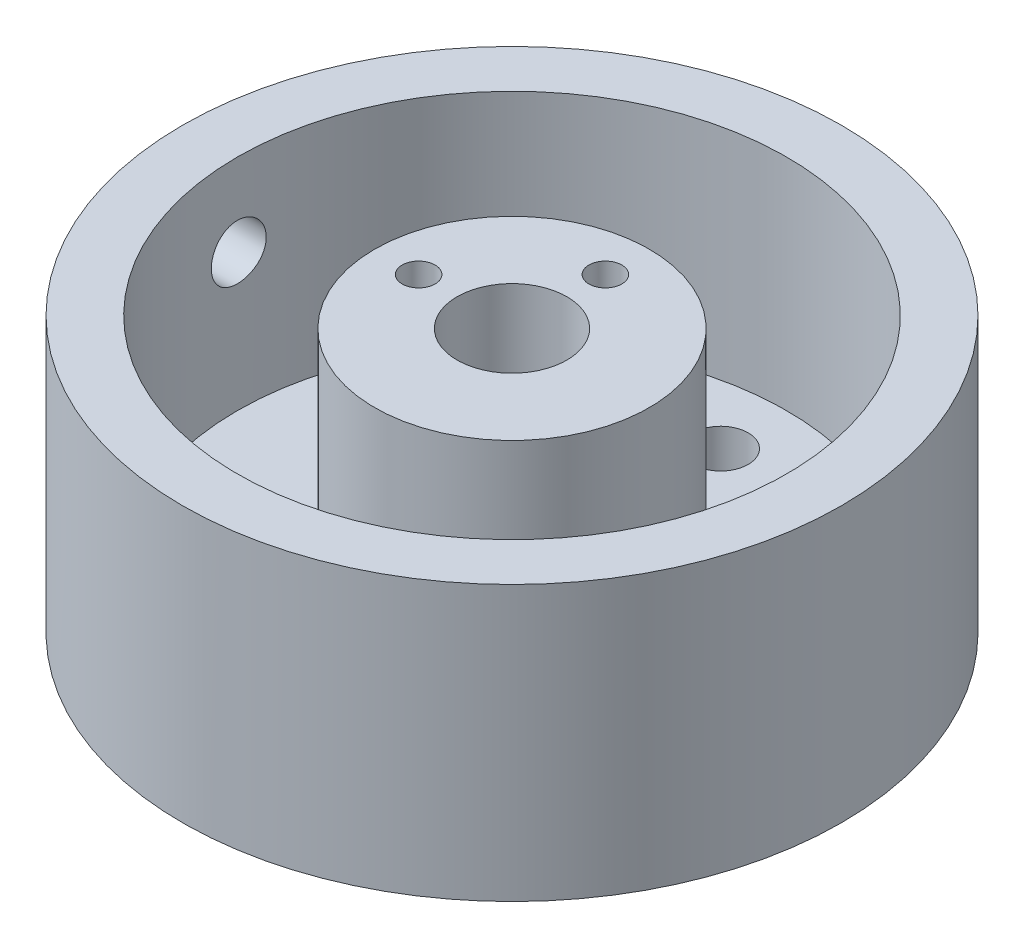
from build123d import *

# Parameters (mm, degrees)
SKETCH2_R                          = 2.5
CUT_EXTRUDE1_DEPTH                 = 10
SKETCH3_R                          = 1.5
CUT_EXTRUDE2_DEPTH                 = 8
SKETCH4_R                          = 1.5
CUT_EXTRUDE3_DEPTH                 = 4
SKETCH5_R                          = 1.5
CUT_EXTRUDE4_DEPTH                 = 4
CUT_EXTRUDE7_DEPTH                 = 10
CUT_EXTRUDE7_DEPTH_BACK            = 10
SKETCH6_R                          = 2.5
BOSS_EXTRUDE5_DEPTH                = 5
BOSS_EXTRUDE5_DEPTH_BACK           = 5
F_5_0_5_DIAMETER_HOLE1_D           = 5
F_5_0_5_DIAMETER_HOLE1_ON_FACE_2_D = 5


with BuildPart() as part:
    # Sketch1 → Revolve2 (revolve)
    with BuildSketch(Plane.XY):
        Polygon((5, 7.28), (5, 0), (30, 0), (30, 25), (25, 25), (25, 5), (12.5, 5), (12.5, 23.98), (5, 23.98), (5, 11.48), (7, 11.48), (7, 7.28), align=None)
    revolve(axis=Axis((0, 23.98, 0), (0, -1, 0)))

    # Sketch2 → Cut-Extrude1 (cut)
    with BuildSketch(Plane.XZ):
        with Locations((0, -19)):
            Circle(SKETCH2_R)
    extrude(amount=-CUT_EXTRUDE1_DEPTH, mode=Mode.SUBTRACT)

    # Sketch3 → Cut-Extrude2 (cut)
    with BuildSketch(Plane(origin=(0, 23.98, 0), x_dir=(1, 0, 0), z_dir=(0, 1, 0))):
        with Locations((-8.5, 0)):
            Circle(SKETCH3_R)
        with Locations((0, 8.5)):
            Circle(SKETCH3_R)
    extrude(amount=-CUT_EXTRUDE2_DEPTH, mode=Mode.SUBTRACT)

    # Sketch4 → Cut-Extrude3 (cut)
    with BuildSketch(Plane.XY.offset(-12.5)):
        with Locations((0, 17.5)):
            Circle(SKETCH4_R)
    extrude(amount=CUT_EXTRUDE3_DEPTH, mode=Mode.SUBTRACT)

    # Sketch5 → Cut-Extrude4 (cut)
    with BuildSketch(Plane(origin=(-12.5, 0, 0), x_dir=(0, 0, -1), z_dir=(1, 0, 0))):
        with Locations((0, 17.5)):
            Circle(SKETCH5_R)
    extrude(amount=CUT_EXTRUDE4_DEPTH, mode=Mode.SUBTRACT)

    # Sketch6 → Cut-Extrude7 (cut, two sides: drawn at the far end of the back side and taken through both)
    with BuildSketch(Plane(origin=(-30, 0, 0), x_dir=(0, 0, -1), z_dir=(1, 0, 0)).offset(-CUT_EXTRUDE7_DEPTH_BACK)):
        with Locations((0, 17.5)):
            Circle(SKETCH6_R)
    extrude(amount=CUT_EXTRUDE7_DEPTH + CUT_EXTRUDE7_DEPTH_BACK, mode=Mode.SUBTRACT)

    # Sketch7 → Boss-Extrude5 (add, two sides: drawn at the far end of the back side and taken through both)
    with BuildSketch(Plane.XY.offset(-BOSS_EXTRUDE5_DEPTH_BACK)):
        with BuildLine():
            Line((-32, 0), (-30, 0))
            Line((-30, 0), (-15, 0))
            Line((-15, 0), (-15, -9.5))
            ThreePointArc((-15, -9.5), (-15.878679656, -11.621320344), (-18, -12.5))
            Line((-18, -12.5), (-32, -12.5))
            ThreePointArc((-32, -12.5), (-34.121320344, -11.621320344), (-35, -9.5))
            Line((-35, -9.5), (-35, -3))
            ThreePointArc((-35, -3), (-34.121320344, -0.878679656), (-32, 0))
        make_face()
    extrude(amount=BOSS_EXTRUDE5_DEPTH + BOSS_EXTRUDE5_DEPTH_BACK)

    # Ø5.0 (5) Diameter Hole1 (through all)
    with Locations(Plane(origin=(-25, -8, -5), x_dir=(-1, 0, 0), z_dir=(0, 0, -1))):
        with Locations((0, 0)):
            Hole(F_5_0_5_DIAMETER_HOLE1_D / 2)

    # Ø5.0 (5) Diameter Hole1 on face 2 (through all)
    with Locations(Plane(origin=(-19.5551144, -17.55502899, 0), x_dir=(-1, 0, 0), z_dir=(0, 0, -1))):
        with Locations((0, 0)):
            Hole(F_5_0_5_DIAMETER_HOLE1_ON_FACE_2_D / 2)


solid = part.part
